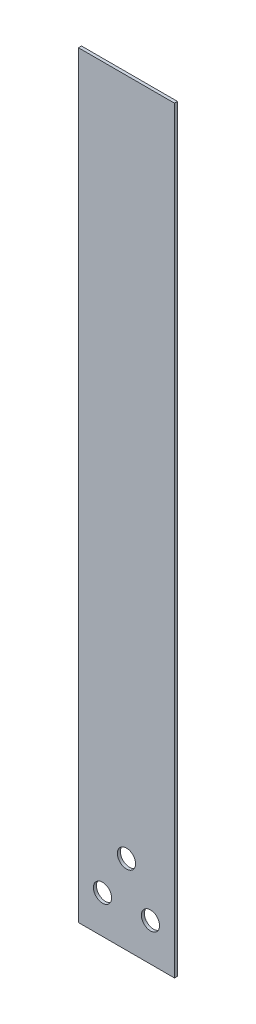
from build123d import *

# Parameters (mm, degrees)
SKETCH_1_W          = 38
SKETCH_1_H          = 300
EXTRUDE_1_DEPTH     = 1.2
CUT_EXTRUDE_1_DEPTH = 1.2


with BuildPart() as part:
    # Эскиз1 → Бобышка-Вытянуть1 (new body)
    with BuildSketch(Plane.XY):
        Rectangle(SKETCH_1_W, SKETCH_1_H)
    extrude(amount=EXTRUDE_1_DEPTH)

    # Эскиз2 → Вырез-Вытянуть1 (cut)
    with BuildSketch(Plane.XY.offset(1.2)):
        with BuildLine():
            ThreePointArc((0, -114.945517328), (-3.6, -118.545517328), (0, -122.145517328))
            Line((0, -122.145517328), (0, -114.945517328))
        make_face()
        with BuildLine():
            Line((0, -114.945517328), (0, -122.145517328))
            ThreePointArc((0, -122.145517328), (2.545584412, -121.09110174), (3.6, -118.545517328))
            ThreePointArc((3.6, -118.545517328), (2.545584412, -115.999932916), (0, -114.945517328))
        make_face()
        with BuildLine():
            ThreePointArc((-5.9, -135), (-9.5, -131.4), (-13.1, -135))
            Line((-13.1, -135), (-5.9, -135))
        make_face()
        with BuildLine():
            Line((-5.9, -135), (-13.1, -135))
            ThreePointArc((-13.1, -135), (-9.5, -138.6), (-5.9, -135))
        make_face()
        with BuildLine():
            ThreePointArc((13.1, -135), (9.5, -131.4), (5.9, -135))
            Line((5.9, -135), (13.1, -135))
        make_face()
        with BuildLine():
            Line((13.1, -135), (5.9, -135))
            ThreePointArc((5.9, -135), (9.5, -138.6), (13.1, -135))
        make_face()
    extrude(amount=-CUT_EXTRUDE_1_DEPTH, mode=Mode.SUBTRACT)


solid = part.part
